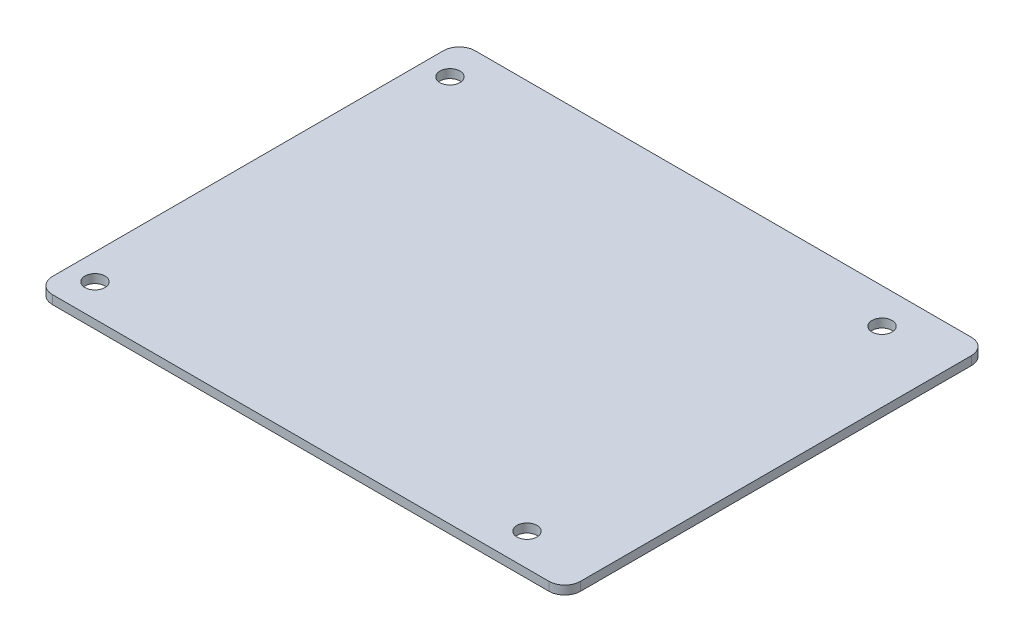
from build123d import *

# Parameters (mm, degrees)
SKETCH1_W           = 100.12
SKETCH1_H           = 80.12
BOSS_EXTRUDE1_DEPTH = 0.825
FILLET1_R           = 3
CUT_EXTRUDE1_REACH  = 66.137
SKETCH2_R           = 1.905


with BuildPart() as part:
    # Sketch1 → Boss-Extrude1 (new, symmetric)
    with BuildSketch(Plane(origin=(0, 0, 0), x_dir=(1, 0, 0), z_dir=(0, 1, 0))):
        Rectangle(SKETCH1_W, SKETCH1_H)
    extrude(amount=BOSS_EXTRUDE1_DEPTH, both=True)

    # Fillet1
    fillet1_edges = [part.edges().sort_by_distance(p)[0] for p in [
        (-50.06, 0, -40.06),
        (50.06, 0, -40.06),
        (50.06, 0, 40.06),
        (-50.06, 0, 40.06),
    ]]
    fillet(fillet1_edges, radius=FILLET1_R)

    # Sketch2 → Cut-Extrude1 (cut, up to next)
    with BuildSketch(Plane(origin=(0, 0.825, 0), x_dir=(1, 0, 0), z_dir=(0, 1, 0)), mode=Mode.PRIVATE) as cut_extrude1_sk1:
        with Locations(Location((-45.155, 33.3925, 0), (0, 0, 270))):
            Circle(SKETCH2_R)
    cut_extrude1_tool1 = extrude(cut_extrude1_sk1.sketch, amount=-CUT_EXTRUDE1_REACH, mode=Mode.PRIVATE) & part.part
    # Sketch2 → Cut-Extrude1 (cut, up to next)
    with BuildSketch(Plane(origin=(0, 0.825, 0), x_dir=(1, 0, 0), z_dir=(0, 1, 0)), mode=Mode.PRIVATE) as cut_extrude1_sk2:
        with Locations(Location((-45.155, -33.9175, 0), (0, 0, 270))):
            Circle(SKETCH2_R)
    cut_extrude1_tool2 = extrude(cut_extrude1_sk2.sketch, amount=-CUT_EXTRUDE1_REACH, mode=Mode.PRIVATE) & part.part
    # Sketch2 → Cut-Extrude1 (cut, up to next)
    with BuildSketch(Plane(origin=(0, 0.825, 0), x_dir=(1, 0, 0), z_dir=(0, 1, 0)), mode=Mode.PRIVATE) as cut_extrude1_sk3:
        with Locations(Location((36.76, -33.9175, 0), (0, 0, 270))):
            Circle(SKETCH2_R)
    cut_extrude1_tool3 = extrude(cut_extrude1_sk3.sketch, amount=-CUT_EXTRUDE1_REACH, mode=Mode.PRIVATE) & part.part
    # Sketch2 → Cut-Extrude1 (cut, up to next)
    with BuildSketch(Plane(origin=(0, 0.825, 0), x_dir=(1, 0, 0), z_dir=(0, 1, 0)), mode=Mode.PRIVATE) as cut_extrude1_sk4:
        with Locations(Location((36.76, 33.3925, 0), (0, 0, 270))):
            Circle(SKETCH2_R)
    cut_extrude1_tool4 = extrude(cut_extrude1_sk4.sketch, amount=-CUT_EXTRUDE1_REACH, mode=Mode.PRIVATE) & part.part
    add(cut_extrude1_tool1.solids().sort_by_distance((-45.155, 0.825, -33.3925))[0], mode=Mode.SUBTRACT)
    add(cut_extrude1_tool2.solids().sort_by_distance((-45.155, 0.825, 33.9175))[0], mode=Mode.SUBTRACT)
    add(cut_extrude1_tool3.solids().sort_by_distance((36.76, 0.825, 33.9175))[0], mode=Mode.SUBTRACT)
    add(cut_extrude1_tool4.solids().sort_by_distance((36.76, 0.825, -33.3925))[0], mode=Mode.SUBTRACT)


solid = part.part
